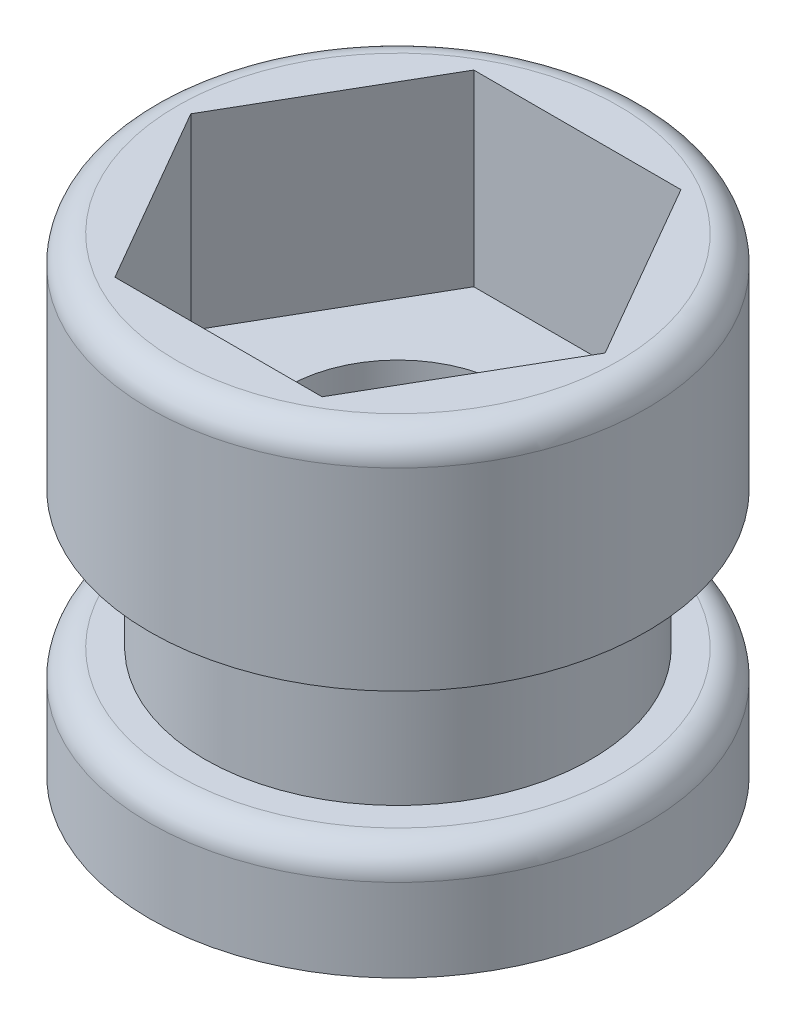
from build123d import *

# Parameters (mm, degrees)
SKETCH1_R           = 9
BOSS_EXTRUDE1_DEPTH = 4
SKETCH2_R           = 7
BOSS_EXTRUDE2_DEPTH = 5
SKETCH4_R           = 9
BOSS_EXTRUDE3_DEPTH = 8
FILLET1_R           = 1
FILLET2_R           = 1
SKETCH5_R           = 4
CUT_EXTRUDE1_DEPTH  = 18
CUT_EXTRUDE2_DEPTH  = 6.8


with BuildPart() as part:
    # Sketch1 → Boss-Extrude1 (new body)
    with BuildSketch(Plane(origin=(0, 0, 0), x_dir=(1, 0, 0), z_dir=(0, 1, 0))):
        with Locations(Location((0, 0, 0), (0, 0, 270))):
            Circle(SKETCH1_R)
    extrude(amount=BOSS_EXTRUDE1_DEPTH)

    # Sketch2 → Boss-Extrude2 (add)
    with BuildSketch(Plane(origin=(0, 4, 0), x_dir=(1, 0, 0), z_dir=(0, 1, 0))):
        with Locations(Location((0, 0, 0), (0, 0, 270))):
            Circle(SKETCH2_R)
    extrude(amount=BOSS_EXTRUDE2_DEPTH)

    # Sketch4 → Boss-Extrude3 (add)
    with BuildSketch(Plane(origin=(0, 9, 0), x_dir=(1, 0, 0), z_dir=(0, 1, 0))):
        with Locations(Location((0, 0, 0), (0, 0, 270))):
            Circle(SKETCH4_R)
    extrude(amount=BOSS_EXTRUDE3_DEPTH)

    # Fillet1
    fillet1_edges = [part.edges().sort_by_distance(p)[0] for p in [
        (0, 17, -9),
    ]]
    fillet(fillet1_edges, radius=FILLET1_R)

    # Fillet2
    fillet2_edges = [part.edges().sort_by_distance(p)[0] for p in [
        (0, 4, -9),
    ]]
    fillet(fillet2_edges, radius=FILLET2_R)

    # Sketch5 → Cut-Extrude1 (cut)
    with BuildSketch(Plane.XZ):
        with Locations(Location((0, 0, 0), (0, 0, 270))):
            Circle(SKETCH5_R)
    extrude(amount=-CUT_EXTRUDE1_DEPTH, mode=Mode.SUBTRACT)

    # Sketch6 → Cut-Extrude2 (cut)
    with BuildSketch(Plane(origin=(0, 17, 0), x_dir=(1, 0, 0), z_dir=(0, 1, 0))):
        Polygon((-7.505553499, 0), (-3.75277675, -6.5), (3.75277675, -6.5), (7.505553499, 0), (3.75277675, 6.5), (-3.75277675, 6.5), align=None)
    extrude(amount=-CUT_EXTRUDE2_DEPTH, mode=Mode.SUBTRACT)


solid = part.part
